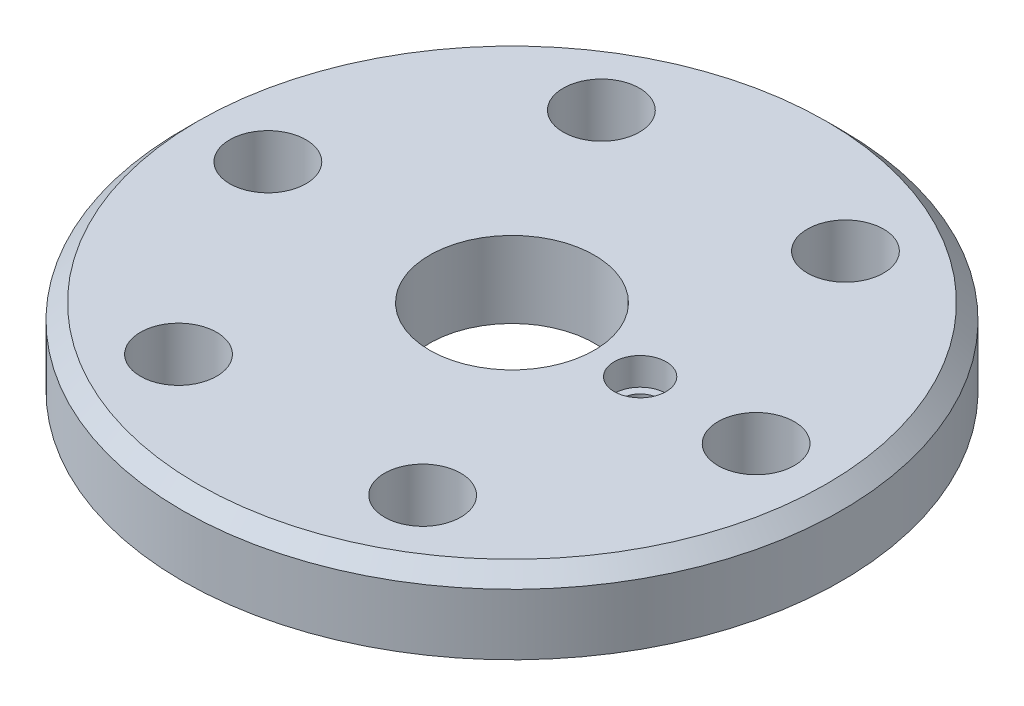
from build123d import *

# Parameters (mm, degrees)
SKETCH1_R               = 108
SKETCH1_R_2             = 27
SKETCH1_R_3             = 12.5
BOSS_EXTRUDE1_DEPTH     = 25
CHAMFER1_SIZE           = 5
M12X0_35_TAPPED_HOLE2_D = 11.65
SKETCH4_R               = 8.5
CUT_EXTRUDE2_DEPTH      = 9


with BuildPart() as part:
    # Sketch1 → Boss-Extrude1 (new body)
    with BuildSketch(Plane(origin=(0, 0, 0), x_dir=(1, 0, 0), z_dir=(0, 1, 0))):
        with Locations(Location((0, 0, 0), (0, 0, 270))):
            Circle(SKETCH1_R)
        with Locations(Location((0, 0, 0), (0, 0, 270))):
            Circle(SKETCH1_R_2, mode=Mode.SUBTRACT)
        with Locations(Location((40, 69.282032303, 0), (0, 0, 270))):
            Circle(SKETCH1_R_3, mode=Mode.SUBTRACT)
        with Locations(Location((80, 0, 0), (0, 0, 270))):
            Circle(SKETCH1_R_3, mode=Mode.SUBTRACT)
        with Locations(Location((40, -69.282032303, 0), (0, 0, 270))):
            Circle(SKETCH1_R_3, mode=Mode.SUBTRACT)
        with Locations(Location((-40, -69.282032303, 0), (0, 0, 270))):
            Circle(SKETCH1_R_3, mode=Mode.SUBTRACT)
        with Locations(Location((-80, 0, 0), (0, 0, 270))):
            Circle(SKETCH1_R_3, mode=Mode.SUBTRACT)
        with Locations(Location((-40, 69.282032303, 0), (0, 0, 270))):
            Circle(SKETCH1_R_3, mode=Mode.SUBTRACT)
    extrude(amount=BOSS_EXTRUDE1_DEPTH)

    # Chamfer1
    chamfer1_edges = [part.edges().sort_by_distance(p)[0] for p in [
        (0, 25, -108),
    ]]
    chamfer(chamfer1_edges, length=CHAMFER1_SIZE)

    # M12x0.35 Tapped Hole2 (through all)
    with Locations(Plane(origin=(42, 0, 0), x_dir=(0, 0, -1), z_dir=(0, -1, 0))):
        with Locations((0, 0)):
            Hole(M12X0_35_TAPPED_HOLE2_D / 2)

    # Sketch4 → Cut-Extrude2 (cut)
    with BuildSketch(Plane(origin=(0, 25, 0), x_dir=(1, 0, 0), z_dir=(0, 1, 0))):
        with Locations(Location((42, 0, 0), (0, 0, 270))):
            Circle(SKETCH4_R)
    extrude(amount=-CUT_EXTRUDE2_DEPTH, mode=Mode.SUBTRACT)


solid = part.part
